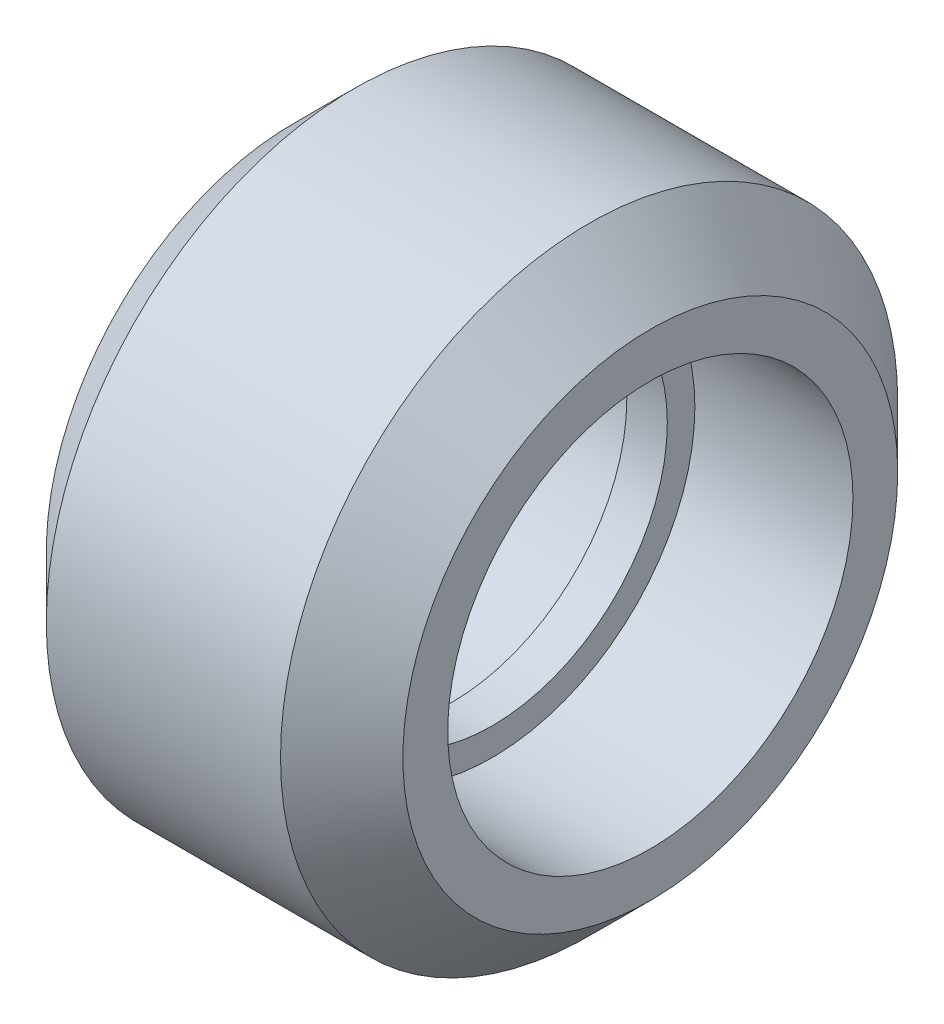
from build123d import *


with BuildPart() as part:
    # Sketch1 → Revolve1 (revolve)
    with BuildSketch(Plane.XY, mode=Mode.PRIVATE) as revolve1_sk:
        Polygon((0.5, 4.32), (-0.5, 4.32), (-0.5, 5), (-4.4, 5), (-4.4, 6.105), (-2.89, 7.615), (2.89, 7.615), (4.4, 6.105), (4.4, 5), (0.5, 5), align=None)
    revolve(revolve1_sk.sketch.rotate(Axis((0, 0, 0), (-1, 0, 0)), 90), axis=Axis((0, 0, 0), (-1, 0, 0)))


solid = part.part
